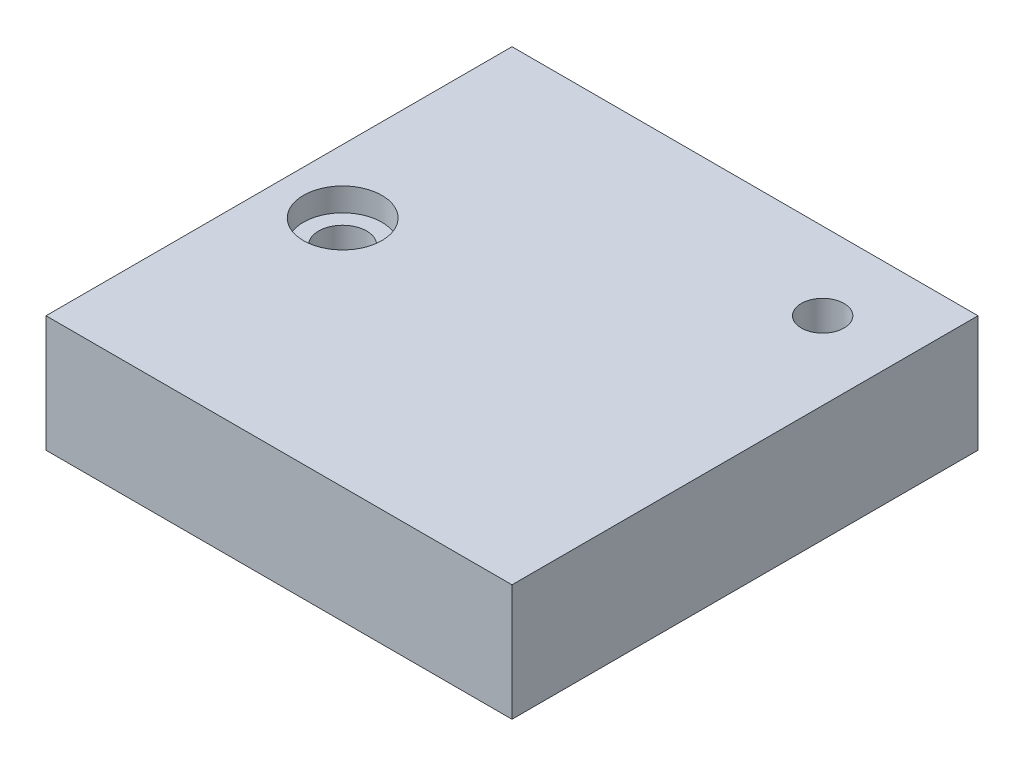
from build123d import *

# Parameters (mm, degrees)
SKETCH2_W           = 60
SKETCH2_H           = 60
BOSS_EXTRUDE1_DEPTH = 15
SKETCH3_R           = 5.05
CUT_EXTRUDE3_DEPTH  = 3
SKETCH5_R           = 3.1
CUT_EXTRUDE4_DEPTH  = 12
SKETCH6_R           = 2.75
CUT_EXTRUDE5_DEPTH  = 5.5


with BuildPart() as part:
    # Sketch2 → Boss-Extrude1 (new body)
    with BuildSketch(Plane(origin=(0, 0, 0), x_dir=(1, 0, 0), z_dir=(0, 1, 0))):
        Rectangle(SKETCH2_W, SKETCH2_H)
    extrude(amount=BOSS_EXTRUDE1_DEPTH)

    # Sketch3 → Cut-Extrude3 (cut)
    with BuildSketch(Plane(origin=(0, 15, 0), x_dir=(1, 0, 0), z_dir=(0, 1, 0))):
        with Locations(Location((-21.804493365, 0, 0), (0, 0, 270))):
            Circle(SKETCH3_R)
    extrude(amount=-CUT_EXTRUDE3_DEPTH, mode=Mode.SUBTRACT)

    # Sketch5 → Cut-Extrude4 (cut)
    with BuildSketch(Plane(origin=(0, 0, 0), x_dir=(1, 0, 0), z_dir=(0, 1, 0))):
        with Locations(Location((-21.804493365, 0, 0), (0, 0, 270))):
            Circle(SKETCH5_R)
    extrude(amount=CUT_EXTRUDE4_DEPTH, mode=Mode.SUBTRACT)

    # Sketch6 → Cut-Extrude5 (cut)
    with BuildSketch(Plane(origin=(0, 15, 0), x_dir=(1, 0, 0), z_dir=(0, 1, 0))):
        with Locations(Location((20, 20, 0), (0, 0, 270))):
            Circle(SKETCH6_R)
    extrude(amount=-CUT_EXTRUDE5_DEPTH, mode=Mode.SUBTRACT)


solid = part.part
